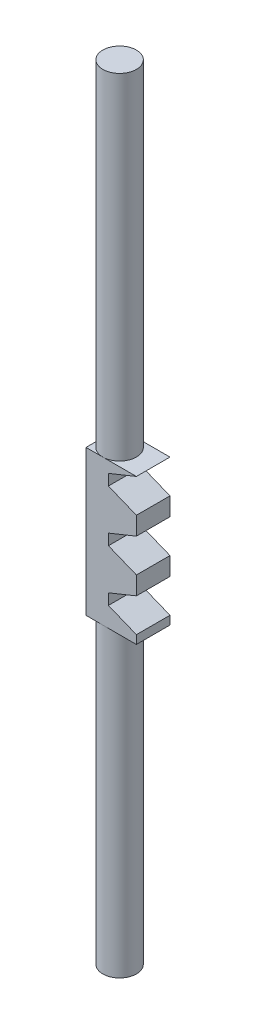
from build123d import *

# Parameters (mm, degrees)
SKETCH1_R                = 1.5
BOSS_EXTRUDE1_DEPTH      = 40
BOSS_EXTRUDE2_DEPTH      = 1.5
BOSS_EXTRUDE2_DEPTH_BACK = 1.5
SKETCH6_W                = 4.5
SKETCH6_H                = 13
CUT_EXTRUDE2_DEPTH       = 4
SKETCH13_R               = 1.5
BOSS_EXTRUDE3_DEPTH      = 30


with BuildPart() as part:
    # Sketch1 → Boss-Extrude1 (new body)
    with BuildSketch(Plane(origin=(0, 0, 0), x_dir=(1, 0, 0), z_dir=(0, 1, 0))):
        Circle(SKETCH1_R)
    extrude(amount=BOSS_EXTRUDE1_DEPTH)

    # Sketch6 → Boss-Extrude2 (add, two sides: drawn at the far end of the back side and taken through both)
    with BuildSketch(Plane.XY.offset(-BOSS_EXTRUDE2_DEPTH_BACK)):
        with Locations((0.75, 33.5)):
            Rectangle(SKETCH6_W, SKETCH6_H)
    extrude(amount=BOSS_EXTRUDE2_DEPTH + BOSS_EXTRUDE2_DEPTH_BACK)

    # Sketch12 → Cut-Extrude2 (cut)
    with BuildSketch(Plane.XY.offset(1.5)):
        Polygon((3, 40), (3, 37), (0.5, 38.010065565), (0.5, 38.989934435), align=None)
        Polygon((0.5, 34.369934435), (0.5, 33.390065565), (3, 32.38), (3, 35.38), align=None)
        Polygon((0.5, 29.749934435), (0.5, 28.770065565), (3, 27.76), (3, 30.76), align=None)
    extrude(amount=-CUT_EXTRUDE2_DEPTH, mode=Mode.SUBTRACT)

    # Sketch13 → Boss-Extrude3 (add)
    with BuildSketch(Plane(origin=(0, 40, 0), x_dir=(1, 0, 0), z_dir=(0, 1, 0))):
        Circle(SKETCH13_R)
    extrude(amount=BOSS_EXTRUDE3_DEPTH)


solid = part.part
